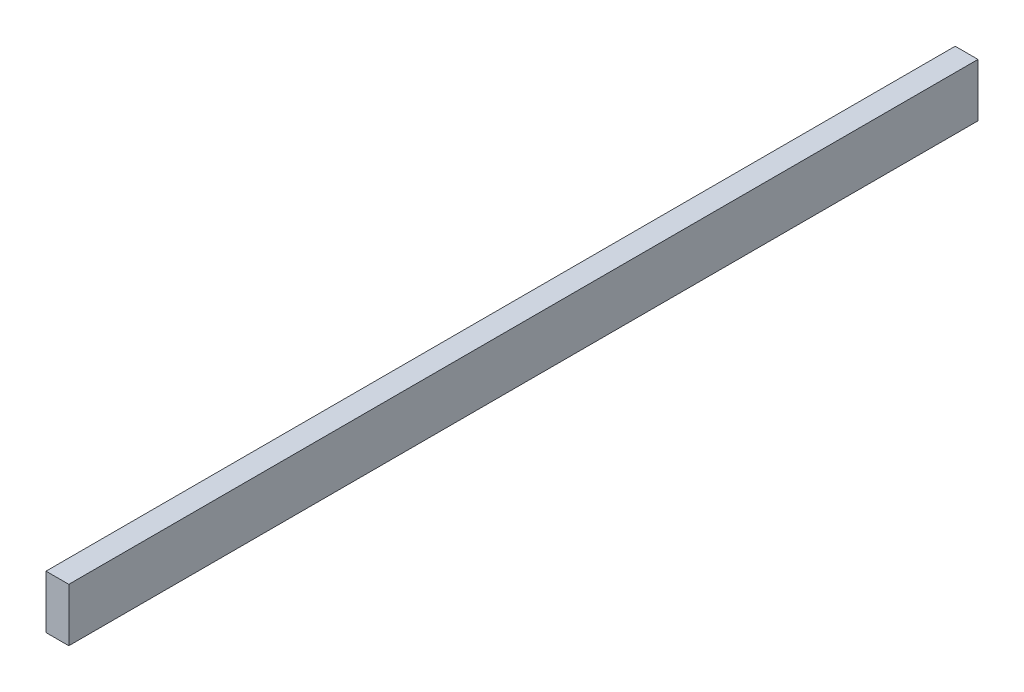
from build123d import *

# Parameters (mm, degrees)
SKETCH1_W           = 38.1
SKETCH1_H           = 88.9
BOSS_EXTRUDE1_DEPTH = 1518.68


with BuildPart() as part:
    # Sketch1 → Boss-Extrude1 (new body)
    with BuildSketch(Plane.XY):
        with Locations((19.05, 44.45)):
            Rectangle(SKETCH1_W, SKETCH1_H)
    extrude(amount=BOSS_EXTRUDE1_DEPTH)


solid = part.part
